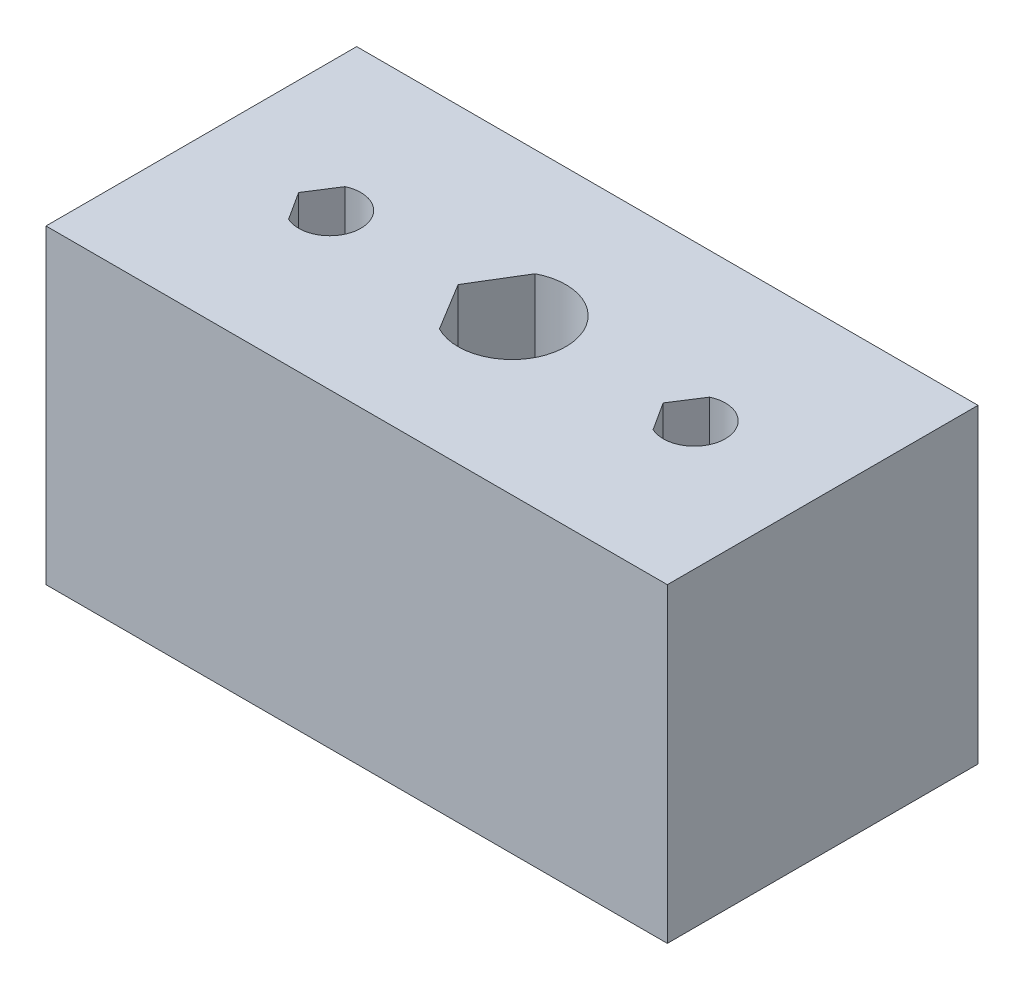
from build123d import *

# Parameters (mm, degrees)
SKETCH1_W           = 30
SKETCH1_H           = 15
BOSS_EXTRUDE1_DEPTH = 15
CUT_EXTRUDE1_DEPTH  = 23.5


with BuildPart() as part:
    # Sketch1 → Boss-Extrude1 (new body)
    with BuildSketch(Plane(origin=(0, 0, 0), x_dir=(1, 0, 0), z_dir=(0, 1, 0))):
        Rectangle(SKETCH1_W, SKETCH1_H)
    extrude(amount=BOSS_EXTRUDE1_DEPTH)

    # Sketch2 → Cut-Extrude1 (cut, through all)
    with BuildSketch(Plane(origin=(0, 15, 0), x_dir=(1, 0, 0), z_dir=(0, 1, 0))):
        with BuildLine():
            Line((-10.3, 0), (-9.424773748, -1.363692694))
            ThreePointArc((-9.424773748, -1.363692694), (-7.3, 0), (-9.424773748, 1.363692694))
            Line((-9.424773748, 1.363692694), (-10.3, 0))
        make_face()
        with BuildLine():
            Line((-2.6, 0), (-1.195098007, -2.309056248))
            ThreePointArc((-1.195098007, -2.309056248), (2.6, 0), (-1.195098007, 2.309056248))
            Line((-1.195098007, 2.309056248), (-2.6, 0))
        make_face()
        with BuildLine():
            Line((7.3, 0), (8.175226252, -1.363692694))
            ThreePointArc((8.175226252, -1.363692694), (10.3, 0), (8.175226252, 1.363692694))
            Line((8.175226252, 1.363692694), (7.3, 0))
        make_face()
    extrude(amount=-CUT_EXTRUDE1_DEPTH, mode=Mode.SUBTRACT)


solid = part.part
